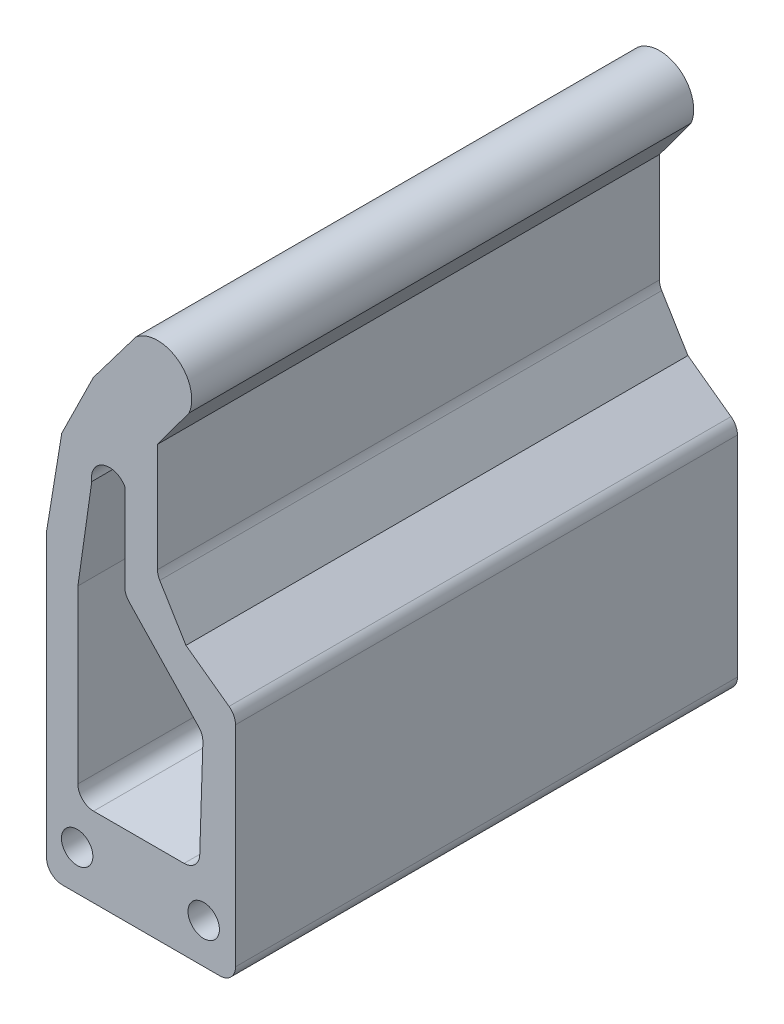
from build123d import *

# Parameters (mm, degrees)
BOSS_EXTRUDE1_DEPTH = 32
CUT_EXTRUDE1_DEPTH  = 32
SKETCH3_R           = 1
CUT_EXTRUDE2_DEPTH  = 32
FILLET2_R           = 1


with BuildPart() as part:
    # Sketch1 → Boss-Extrude1 (new body)
    with BuildSketch(Plane.XY.offset(40)):
        with BuildLine():
            Line((-300, 367), (-300, 348))
            Line((-300, 348), (-287.95160644, 348))
            Line((-287.95160644, 348), (-287.95160644, 362.871836257))
            Line((-287.95160644, 362.871836257), (-291.110931396, 365.166412354))
            Line((-291.110931396, 365.166412354), (-292.925810618, 368.159105691))
            Line((-292.925810618, 368.159105691), (-292.925810618, 375.359105691))
            Line((-292.925810618, 375.359105691), (-290.910509572, 378.097455869))
            ThreePointArc((-290.910509572, 378.097455869), (-291.625724396, 380.675408146), (-294.299987793, 380.600006104))
            Line((-294.299987793, 380.600006104), (-297.012375964, 377.009330623))
            Line((-297.012375964, 377.009330623), (-299.029605392, 372.921007879))
            Line((-299.029605392, 372.921007879), (-300, 367))
        make_face()
    extrude(amount=BOSS_EXTRUDE1_DEPTH)

    # Sketch2 → Cut-Extrude1 (cut)
    with BuildSketch(Plane.XY.offset(72)):
        with BuildLine():
            Line((-297.116612998, 371.207677878), (-298, 365))
            Line((-298, 365), (-298, 353.070416706))
            Line((-298, 353.070416706), (-290.26344591, 353.070416706))
            Line((-290.26344591, 353.070416706), (-290.018829346, 360.778991699))
            Line((-290.018829346, 360.778991699), (-295.010009766, 366.046598155))
            Line((-295.010009766, 366.046598155), (-295.010009766, 371.995180703))
            ThreePointArc((-295.010009766, 371.995180703), (-296.391652801, 372.479756418), (-297.116612998, 371.207677878))
        make_face()
    extrude(amount=-CUT_EXTRUDE1_DEPTH, mode=Mode.SUBTRACT)

    # Sketch3 → Cut-Extrude2 (cut)
    with BuildSketch(Plane.XY.offset(72)):
        with Locations((-298.046417962, 350.546056216)):
            Circle(SKETCH3_R)
        with Locations((-289.979523898, 350.546056216)):
            Circle(SKETCH3_R)
    extrude(amount=-CUT_EXTRUDE2_DEPTH, mode=Mode.SUBTRACT)

    # Fillet2
    fillet2_edges = [part.edges().sort_by_distance(p)[0] for p in [
        (-292.925810618, 368.159105691, 56),
        (-287.95160644, 362.871836257, 56),
        (-287.95160644, 348, 56),
        (-300, 348, 56),
        (-295.010009766, 366.046598155, 56),
        (-290.018829346, 360.778991699, 56),
        (-290.26344591, 353.070416706, 56),
        (-298, 353.070416706, 56),
    ]]
    fillet(fillet2_edges, radius=FILLET2_R)


solid = part.part
